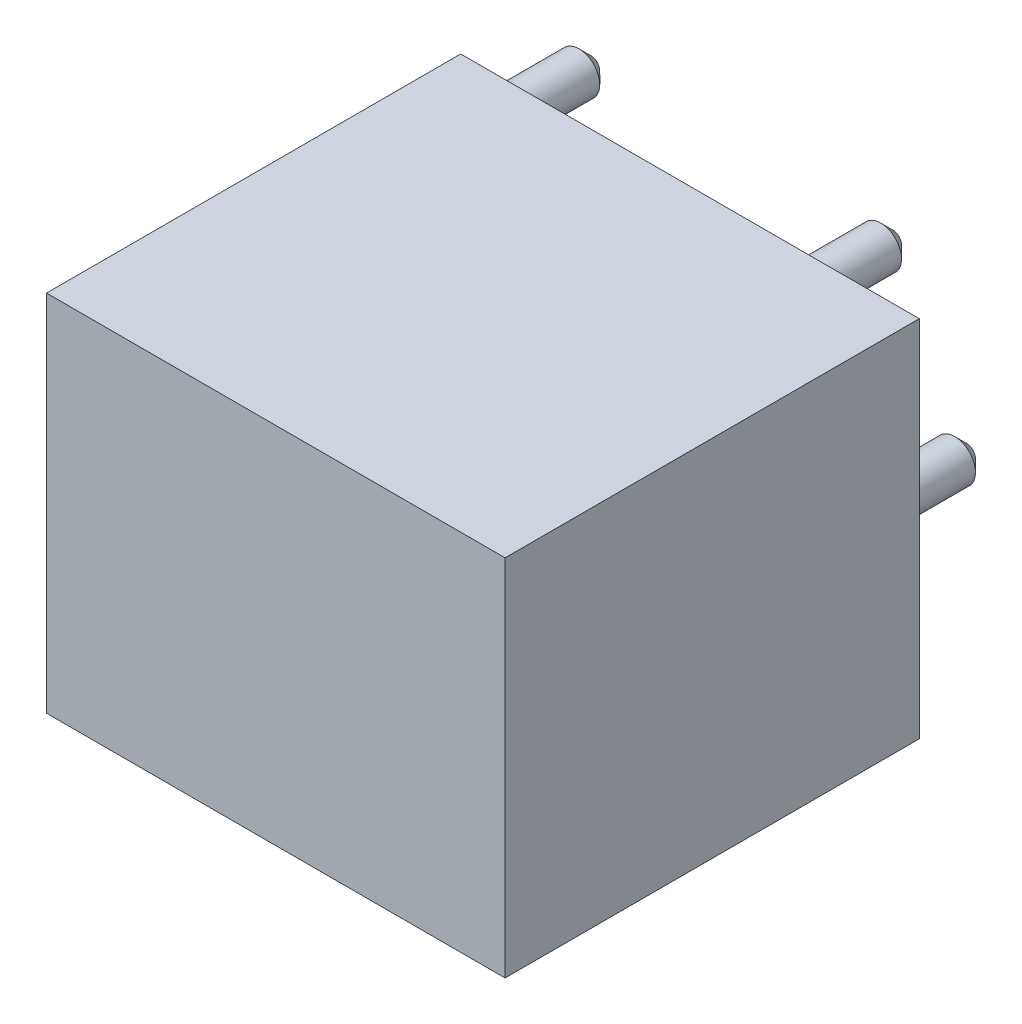
from build123d import *

# Parameters (mm, degrees)
SKETCH1_W           = 15.5
SKETCH1_H           = 12.3
BOSS_EXTRUDE1_DEPTH = 7
SKETCH2_R           = 0.7
BOSS_EXTRUDE2_DEPTH = 3
CHAMFER1_SIZE       = 0.4


with BuildPart() as part:
    # Sketch1 → Boss-Extrude1 (new, symmetric)
    with BuildSketch(Plane.XY):
        Rectangle(SKETCH1_W, SKETCH1_H)
    extrude(amount=BOSS_EXTRUDE1_DEPTH, both=True)

    # Sketch2 → Boss-Extrude2 (add)
    with BuildSketch(Plane(origin=(0, 0, -7), x_dir=(-1, 0, 0), z_dir=(0, 0, -1))):
        with Locations(Location((-3.85, 5, 0), (0, 0, 180))):
            Circle(SKETCH2_R)
        with Locations(Location((6.35, 5, 0), (0, 0, 180))):
            Circle(SKETCH2_R)
        with Locations(Location((6.35, -5, 0), (0, 0, 180))):
            Circle(SKETCH2_R)
        with Locations(Location((-3.85, -5, 0), (0, 0, 180))):
            Circle(SKETCH2_R)
        with Locations(Location((-6.35, 0, 0), (0, 0, 180))):
            Circle(SKETCH2_R)
    extrude(amount=BOSS_EXTRUDE2_DEPTH)

    # Chamfer1
    chamfer1_edges = [part.edges().sort_by_distance(p)[0] for p in [
        (3.15, 5, -10),
        (-7.05, 5, -10),
        (-7.05, -5, -10),
        (3.15, -5, -10),
        (5.65, 0, -10),
    ]]
    chamfer(chamfer1_edges, length=CHAMFER1_SIZE)


solid = part.part
